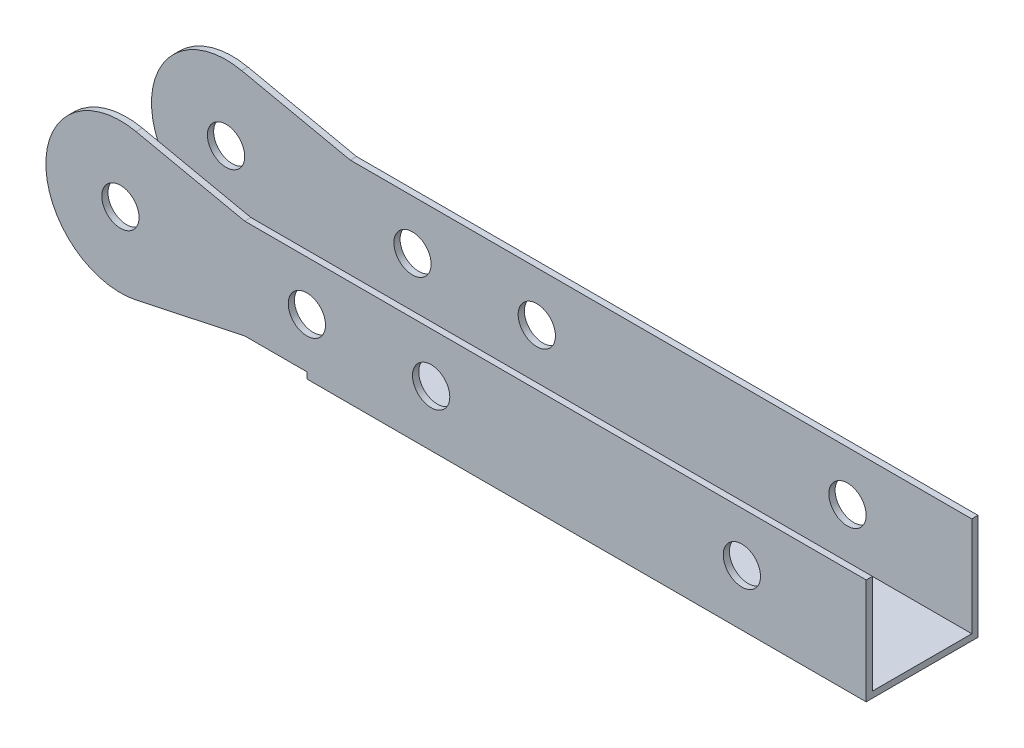
from build123d import *

# Parameters (mm, degrees)
SKETCH_3_R      = 1.5
EXTRUDE_1_DEPTH = 0.5
SKETCH_1_R      = 1.5
EXTRUDE_2_DEPTH = 0.5
SKETCH_4_W      = 45
SKETCH_4_H      = 9
EXTRUDE_3_DEPTH = 0.5


with BuildPart() as part:
    # 草图3 → 凸台-拉伸1 (new body)
    with BuildSketch(Plane.XY.offset(8)):
        with BuildLine():
            Line((-26.8, 8.010393038), (-35.54709074, 9.878119888))
            ThreePointArc((-35.54709074, 9.878119888), (-42.8, 4.010393038), (-35.54709074, -1.857333812))
            Line((-35.54709074, -1.857333812), (-26.8, 0.010393038))
            Line((-26.8, 0.010393038), (23.2, 0.010393038))
            Line((23.2, 0.010393038), (23.2, 8.010393038))
            Line((23.2, 8.010393038), (-26.8, 8.010393038))
        make_face()
        with Locations((13.2, 4.010393038)):
            Circle(SKETCH_3_R, mode=Mode.SUBTRACT)
        with Locations((-11.8, 4.010393038)):
            Circle(SKETCH_3_R, mode=Mode.SUBTRACT)
        with Locations((-21.8, 4.010393038)):
            Circle(SKETCH_3_R, mode=Mode.SUBTRACT)
        with Locations((-36.8, 4.010393038)):
            Circle(SKETCH_3_R, mode=Mode.SUBTRACT)
    extrude(amount=EXTRUDE_1_DEPTH)



with BuildPart() as body_2:
    # 草图1 → 凸台-拉伸2 (new body)
    with BuildSketch(Plane.XY):
        with BuildLine():
            Line((23.2, 8.010393038), (-26.8, 8.010393038))
            Line((-26.8, 8.010393038), (-35.54709074, 9.878119888))
            ThreePointArc((-35.54709074, 9.878119888), (-42.8, 4.010393038), (-35.54709074, -1.857333812))
            Line((-35.54709074, -1.857333812), (-26.8, 0.010393038))
            Line((-26.8, 0.010393038), (23.2, 0.010393038))
            Line((23.2, 0.010393038), (23.2, 8.010393038))
        make_face()
        with Locations((-36.8, 4.010393038)):
            Circle(SKETCH_1_R, mode=Mode.SUBTRACT)
        with Locations((-21.8, 4.010393038)):
            Circle(SKETCH_1_R, mode=Mode.SUBTRACT)
        with Locations((-11.8, 4.010393038)):
            Circle(SKETCH_1_R, mode=Mode.SUBTRACT)
        with Locations((13.2, 4.010393038)):
            Circle(SKETCH_1_R, mode=Mode.SUBTRACT)
    extrude(amount=-EXTRUDE_2_DEPTH)


with BuildPart() as part_1:
    add(part.part)

    add(body_2.part)  # 凸台-拉伸3 merges body 2
    # 草图4 → 凸台-拉伸3 (add)
    with BuildSketch(Plane.XZ.offset(-0.010393038)):
        with Locations((0.7, 4)):
            Rectangle(SKETCH_4_W, SKETCH_4_H)
    extrude(amount=EXTRUDE_3_DEPTH)


solid = part_1.part
